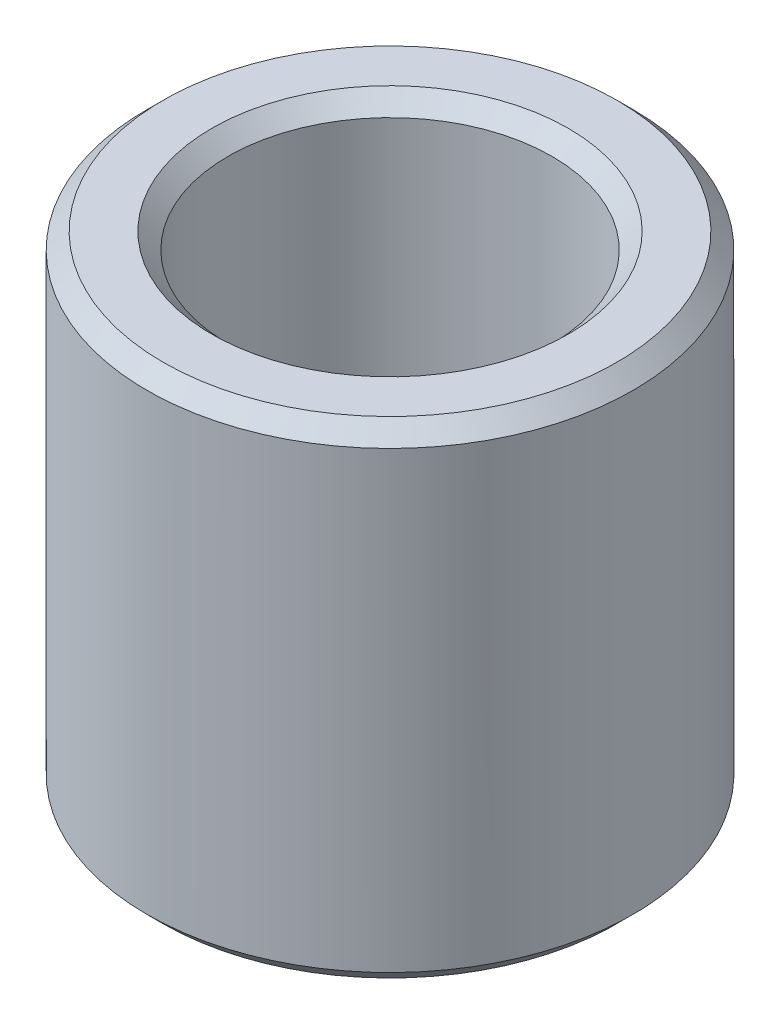
from build123d import *

# Parameters (mm, degrees)
SKETCH_1_W     = 1
SKETCH_1_H     = 6
CHAMFER_1_SIZE = 0.2


with BuildPart() as part:
    # 草图1 → 旋转1 (revolve)
    with BuildSketch(Plane.XY, mode=Mode.PRIVATE) as revolve_1_sk:
        with Locations((-2.5, 0)):
            Rectangle(SKETCH_1_W, SKETCH_1_H)
    revolve(revolve_1_sk.sketch.rotate(Axis((0, 0, 0), (0, 1, 0)), 270), axis=Axis((0, 0, 0), (0, 1, 0)))

    # 倒角1
    chamfer_1_edges = [part.edges().sort_by_distance(p)[0] for p in [
        (0, 3, 2),
        (0, 3, 3),
        (0, -3, 3),
        (0, -3, 2),
    ]]
    chamfer(chamfer_1_edges, length=CHAMFER_1_SIZE)


solid = part.part
